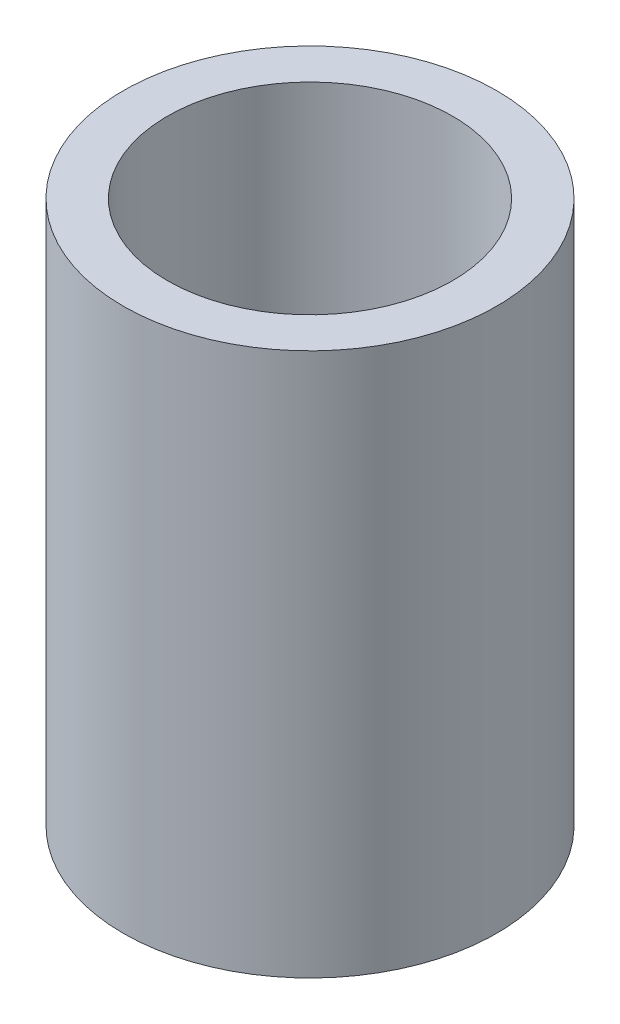
from build123d import *

# Parameters (mm, degrees)
SKETCH1_R           = 5.5
SKETCH1_R_2         = 4.2
BOSS_EXTRUDE1_DEPTH = 16


with BuildPart() as part:
    # Sketch1 → Boss-Extrude1 (new body)
    with BuildSketch(Plane(origin=(0, 0, 0), x_dir=(1, 0, 0), z_dir=(0, 1, 0))):
        with Locations(Location((0, 0, 0), (0, 0, 270))):
            Circle(SKETCH1_R)
        with Locations(Location((0, 0, 0), (0, 0, 270))):
            Circle(SKETCH1_R_2, mode=Mode.SUBTRACT)
    extrude(amount=BOSS_EXTRUDE1_DEPTH)


solid = part.part
